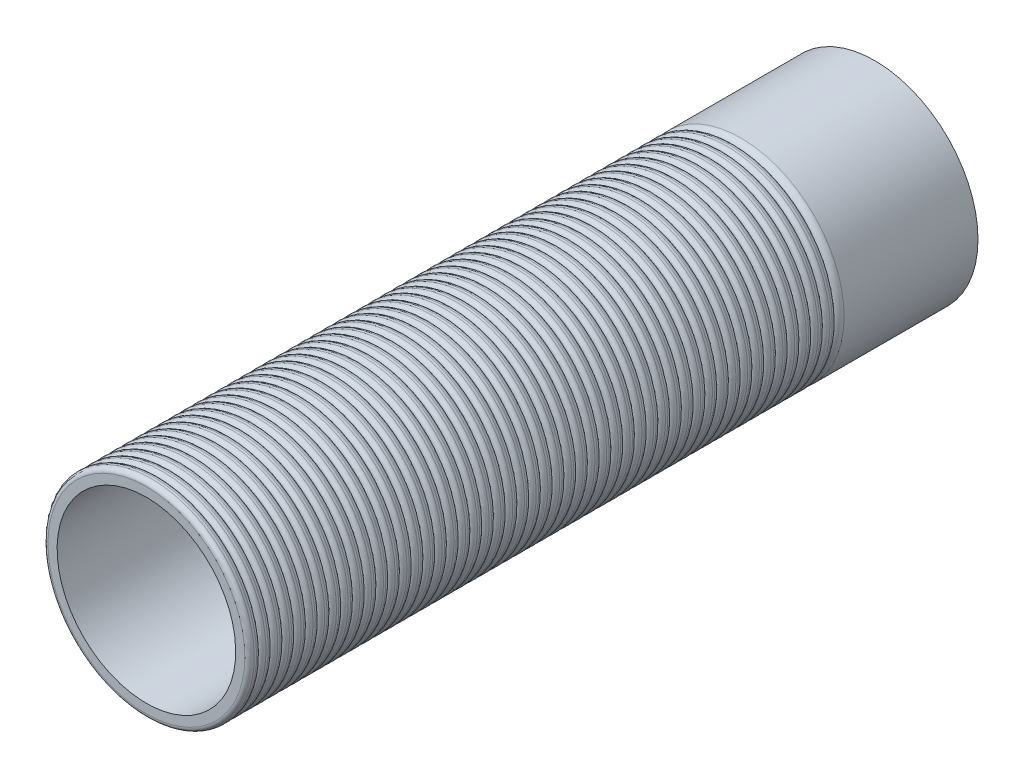
from build123d import *

# Parameters (mm, degrees)
SKETCH1_R           = 43.9
SKETCH1_R_2         = 38
BOSS_EXTRUDE1_DEPTH = 60
FILLET1_R           = 3
LPATTERN1_COUNT     = 50
LPATTERN1_PITCH     = 5


with BuildPart() as part:
    # Sketch1 → Boss-Extrude1 (new body)
    with BuildSketch(Plane.XY):
        Circle(SKETCH1_R)
        Circle(SKETCH1_R_2, mode=Mode.SUBTRACT)
    extrude(amount=BOSS_EXTRUDE1_DEPTH)

    # Fillet1
    fillet1_edges = [part.edges().sort_by_distance(p)[0] for p in [
        (-43.9, 0, 60),
    ]]
    fillet(fillet1_edges, radius=FILLET1_R)

    # Sketch2 → Revolve1 (revolve)
    with BuildSketch(Plane(origin=(0, 0, 0), x_dir=(0, 0, -1), z_dir=(1, 0, 0))):
        with BuildLine():
            Line((-60, 38), (-65, 38))
            Line((-65, 38), (-65, 41.9))
            ThreePointArc((-65, 41.9), (-64.414213562, 43.314213562), (-63, 43.9))
            Line((-63, 43.9), (-62, 43.9))
            ThreePointArc((-62, 43.9), (-60.585786438, 43.314213562), (-60, 41.9))
            Line((-60, 41.9), (-60, 38))
        make_face()
    revolve1 = revolve(axis=Axis((0, 0, 0), (0, 0, 1)))

    # LPattern1: Revolve1 ×50
    with Locations(*[(0, 0, i * LPATTERN1_PITCH) for i in range(1, LPATTERN1_COUNT)]):
        add(revolve1)


solid = part.part
